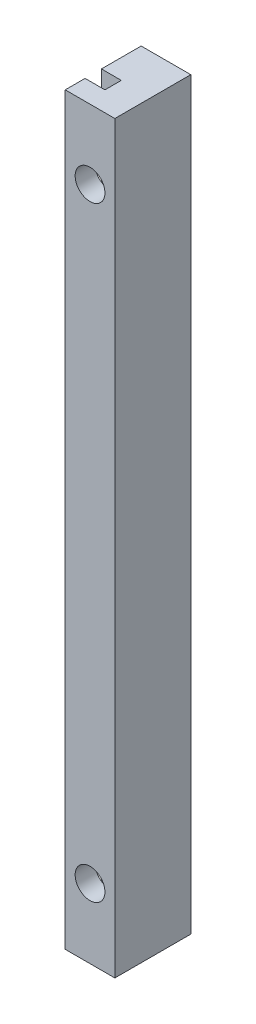
from build123d import *

# Parameters (mm, degrees)
SKETCH1_W           = 5
SKETCH1_H           = 75
BOSS_EXTRUDE1_DEPTH = 4
SKETCH2_W           = 3
SKETCH2_H           = 75
BOSS_EXTRUDE2_DEPTH = 1.65
SKETCH3_W           = 5
SKETCH3_H           = 75
BOSS_EXTRUDE3_DEPTH = 2
SKETCH4_R           = 1.5
CUT_EXTRUDE1_DEPTH  = 87.136650155


with BuildPart() as part:
    # Sketch1 → Boss-Extrude1 (new body)
    with BuildSketch(Plane.XY):
        with Locations((-28.5, -42.5)):
            Rectangle(SKETCH1_W, SKETCH1_H)
    extrude(amount=BOSS_EXTRUDE1_DEPTH)

    # Sketch2 → Boss-Extrude2 (add)
    with BuildSketch(Plane.XY.offset(4)):
        with Locations((-27.5, -42.5)):
            Rectangle(SKETCH2_W, SKETCH2_H)
    extrude(amount=BOSS_EXTRUDE2_DEPTH)

    # Sketch3 → Boss-Extrude3 (add)
    with BuildSketch(Plane.XY.offset(5.65)):
        with Locations((-28.5, -42.5)):
            Rectangle(SKETCH3_W, SKETCH3_H)
    extrude(amount=BOSS_EXTRUDE3_DEPTH)

    # Sketch4 → Cut-Extrude1 (cut, through all)
    with BuildSketch(Plane.XY.offset(7.65)):
        with Locations((-28.5, -73)):
            Circle(SKETCH4_R)
        with Locations((-28.5, -12)):
            Circle(SKETCH4_R)
    extrude(amount=-CUT_EXTRUDE1_DEPTH, mode=Mode.SUBTRACT)


solid = part.part
